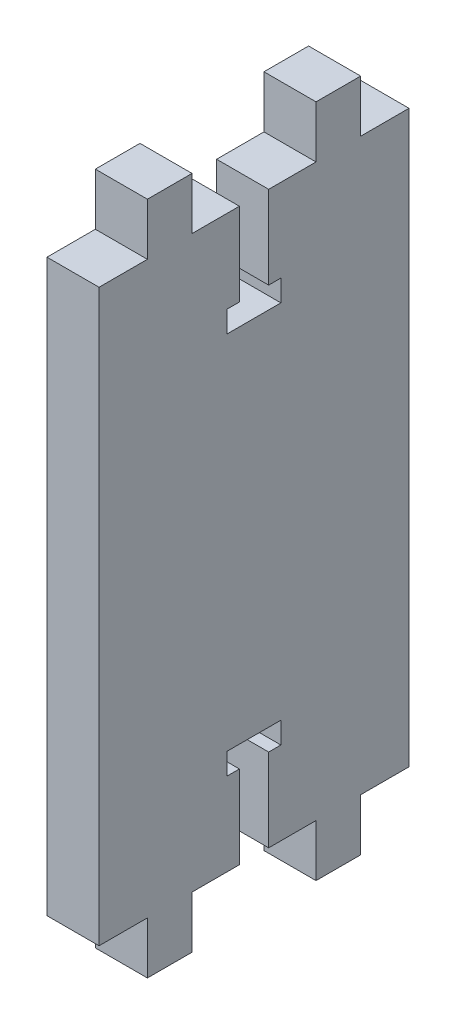
from build123d import *

# Parameters (mm, degrees)
SKETCH1_W           = 4.572
SKETCH1_H           = 5.334
BOSS_EXTRUDE1_DEPTH = 5.334


with BuildPart() as part:
    # Sketch1 → Boss-Extrude1 (new body)
    with BuildSketch(Plane(origin=(0, 0, 0), x_dir=(0, 0, -1), z_dir=(1, 0, 0))):
        Polygon((-15.875, -29.21), (-1.5, -29.21), (-1.5, -20.71), (-2.75, -20.71), (-2.75, -18.51), (2.75, -18.51), (2.75, -20.71), (1.5, -20.71), (1.5, -29.21), (15.875, -29.21), (15.875, 29.21), (10.922, 29.21), (10.922, 34.544), (6.35, 34.544), (6.35, 29.21), (1.5, 29.21), (1.5, 20.71), (2.75, 20.71), (2.75, 18.51), (-2.75, 18.51), (-2.75, 20.71), (-1.5, 20.71), (-1.5, 29.21), (-6.35, 29.21), (-6.35, 34.544), (-10.922, 34.544), (-10.922, 29.21), (-15.875, 29.21), align=None)
        with Locations((-8.636, -31.877)):
            Rectangle(SKETCH1_W, SKETCH1_H)
        with Locations((8.636, -31.877)):
            Rectangle(SKETCH1_W, SKETCH1_H)
    extrude(amount=BOSS_EXTRUDE1_DEPTH)


solid = part.part
